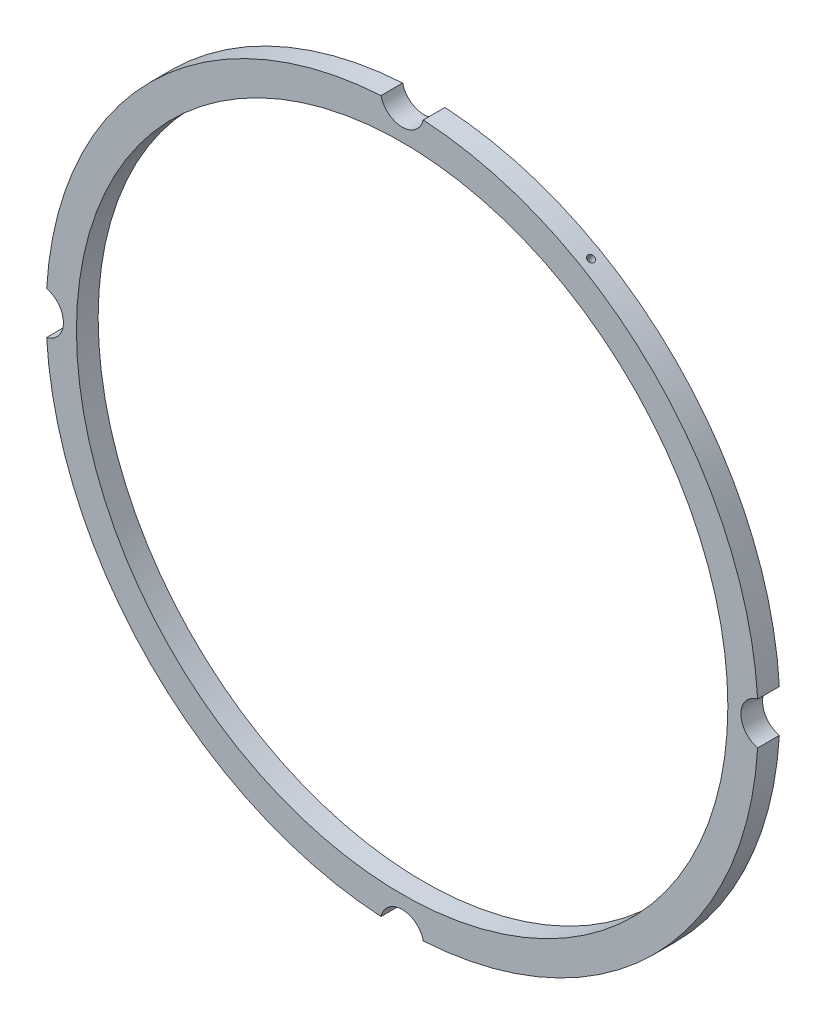
from build123d import *

# Parameters (mm, degrees)
SKETCH1_R                 = 82
SKETCH1_R_2               = 75
BOSS_EXTRUDE1_DEPTH       = 5
SKETCH2_R                 = 5
CUT_EXTRUDE1_DEPTH        = 117.073252733
CIRPATTERN1_COUNT         = 4
M2X0_4_TAPPED_HOLE1_D     = 1.6
M2X0_4_TAPPED_HOLE1_DEPTH = 10
M2X0_4_TAPPED_HOLE1_TIP   = 0.480688495


with BuildPart() as part:
    # Sketch1 → Boss-Extrude1 (new body)
    with BuildSketch(Plane.XY):
        Circle(SKETCH1_R)
        Circle(SKETCH1_R_2, mode=Mode.SUBTRACT)
    extrude(amount=BOSS_EXTRUDE1_DEPTH)

    # Sketch2 → Cut-Extrude1 (cut, through all)
    with BuildSketch(Plane.XY.offset(5)):
        with Locations((0, 83)):
            Circle(SKETCH2_R)
    cut_extrude1 = extrude(amount=-CUT_EXTRUDE1_DEPTH, mode=Mode.SUBTRACT)

    # CirPattern1: Cut-Extrude1 ×4 about axis
    cirpattern1_axis = Axis((0, 0, 0), (0, 0, 1))
    for i in range(1, CIRPATTERN1_COUNT):
        add(cut_extrude1.rotate(cirpattern1_axis, i * 360 / CIRPATTERN1_COUNT), mode=Mode.SUBTRACT)

    # M2x0.4 Tapped Hole1
    with Locations(Plane(origin=(41, 71.01408311, 2.5), x_dir=(0.866025403784, -0.5, 0), z_dir=(0.5, 0.866025403784, 0))):
        with Locations((0, 0)):
            Hole(M2X0_4_TAPPED_HOLE1_D / 2, depth=M2X0_4_TAPPED_HOLE1_DEPTH)
            with Locations((0, 0, -(M2X0_4_TAPPED_HOLE1_DEPTH + M2X0_4_TAPPED_HOLE1_TIP / 2))):  # 118° drill point
                Cone(0, M2X0_4_TAPPED_HOLE1_D / 2, M2X0_4_TAPPED_HOLE1_TIP, mode=Mode.SUBTRACT)


solid = part.part
